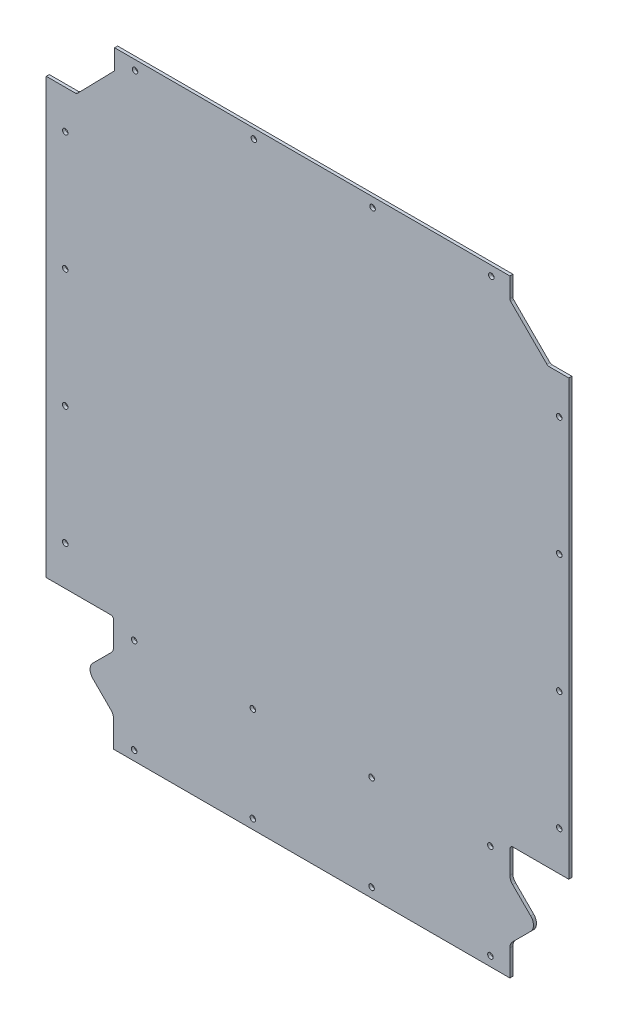
from build123d import *

# Parameters (mm, degrees)
SKETCH2_W            = 550
SKETCH2_H            = 640
BOSS_EXTRUDE1_DEPTH  = 3.175
CUT_EXTRUDE1_DEPTH   = 844.866150894
FILLET1_R            = 10
FILLET2_R            = 3.175
M5_CLEARANCE_HOLE1_D = 5.8
LPATTERN1_COUNT      = 4
LPATTERN1_PITCH      = 125
M5_CLEARANCE_HOLE2_D = 5.8
LPATTERN2_COUNT      = 4
LPATTERN2_PITCH      = 125
M5_CLEARANCE_HOLE3_D = 5.8
LPATTERN3_COUNT      = 4
LPATTERN3_PITCH      = 125


with BuildPart() as part:
    # Sketch2 → Boss-Extrude1 (new body)
    with BuildSketch(Plane.XY):
        with Locations((275, 320)):
            Rectangle(SKETCH2_W, SKETCH2_H)
    extrude(amount=BOSS_EXTRUDE1_DEPTH)

    # Sketch3 → Cut-Extrude1 (cut, through all)
    with BuildSketch(Plane.XY.offset(3.175)):
        Polygon((0, 640), (0, 578), (32, 578), (72, 619), (72, 640), align=None)
        Polygon((488, 618), (488, 640), (550, 640), (550, 578), (528, 578), align=None)
        Polygon((0, 121), (71, 121), (71, 89.5), (42, 60.5), (71, 31.5), (71, 0), (0, 0), align=None)
        Polygon((550, 0), (550, 121), (488, 121), (488, 89.5), (517, 60.5), (488, 31.5), (488, 0), align=None)
    extrude(amount=-CUT_EXTRUDE1_DEPTH, mode=Mode.SUBTRACT)

    # Fillet1
    fillet1_edges = [part.edges().sort_by_distance(p)[0] for p in [
        (71, 89.5, 1.5875),
        (42, 60.5, 1.5875),
        (71, 31.5, 1.5875),
        (488, 31.5, 1.5875),
        (517, 60.5, 1.5875),
        (488, 89.5, 1.5875),
    ]]
    fillet(fillet1_edges, radius=FILLET1_R)

    # Fillet2
    fillet2_edges = [part.edges().sort_by_distance(p)[0] for p in [
        (72, 619, 1.5875),
        (32, 578, 1.5875),
        (528, 578, 1.5875),
        (488, 618, 1.5875),
        (71, 121, 1.5875),
        (488, 121, 1.5875),
    ]]
    fillet(fillet2_edges, radius=FILLET2_R)

    # M5 Clearance Hole1 (through all)
    with Locations(Plane(origin=(93.5, 630, 3.175), x_dir=(1, 0, 0), z_dir=(0, 0, 1))):
        with Locations((0, 0)):
            m5_clearance_hole1 = Hole(M5_CLEARANCE_HOLE1_D / 2)

    # LPattern1: M5 Clearance Hole1 ×4
    with Locations(*[(i * LPATTERN1_PITCH, 0, 0) for i in range(1, LPATTERN1_COUNT)]):
        add(m5_clearance_hole1, mode=Mode.SUBTRACT)

    # M5 Clearance Hole2 (through all)
    with Locations(Plane(origin=(20, 162.5, 3.175), x_dir=(1, 0, 0), z_dir=(0, 0, 1))):
        with Locations((0, 0), (520, 0)):
            m5_clearance_hole2 = Hole(M5_CLEARANCE_HOLE2_D / 2)

    # LPattern2: M5 Clearance Hole2 ×4
    with Locations(*[(0, i * LPATTERN2_PITCH, 0) for i in range(1, LPATTERN2_COUNT)]):
        add(m5_clearance_hole2, mode=Mode.SUBTRACT)

    # M5 Clearance Hole3 (through all)
    with Locations(Plane(origin=(92.5, 110, 3.175), x_dir=(1, 0, 0), z_dir=(0, 0, 1))):
        with Locations((0, 0), (0, -100)):
            m5_clearance_hole3 = Hole(M5_CLEARANCE_HOLE3_D / 2)

    # LPattern3: M5 Clearance Hole3 ×4
    with Locations(*[(i * LPATTERN3_PITCH, 0, 0) for i in range(1, LPATTERN3_COUNT)]):
        add(m5_clearance_hole3, mode=Mode.SUBTRACT)


solid = part.part
